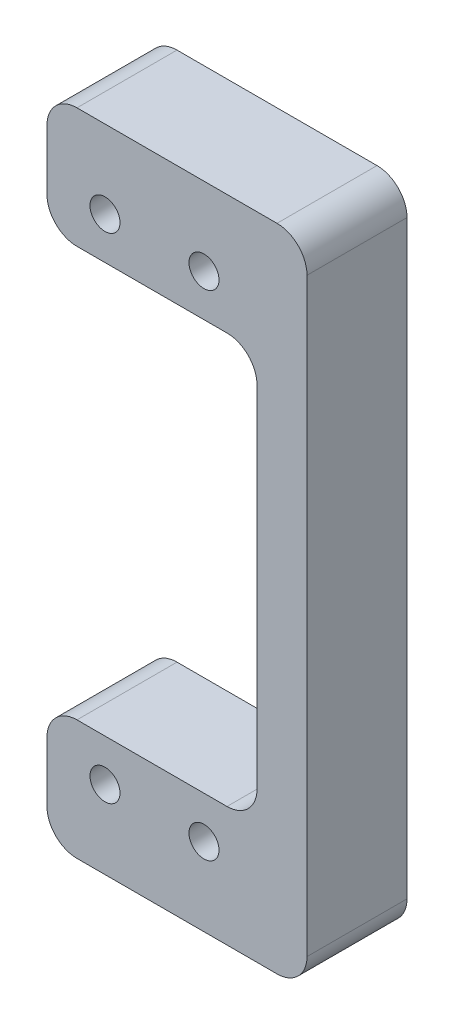
from build123d import *

# Parameters (mm, degrees)
BOSS_EXTRUDE1_DEPTH   = 10
FILLET1_R             = 3
F_3_0MM_DOWEL_HOLE1_D = 3


with BuildPart() as part:
    # Sketch1 → Boss-Extrude1 (new body)
    with BuildSketch(Plane.XY):
        Polygon((0, -20.5), (0, 20.5), (-21, 20.5), (-21, 32.5), (5, 32.5), (5, -32.5), (-21, -32.5), (-21, -20.5), align=None)
    extrude(amount=BOSS_EXTRUDE1_DEPTH)

    # Fillet1
    fillet1_edges = [part.edges().sort_by_distance(p)[0] for p in [
        (0, -20.5, 5),
        (0, 20.5, 5),
        (-21, 20.5, 5),
        (-21, 32.5, 5),
        (5, 32.5, 5),
        (5, -32.5, 5),
        (-21, -32.5, 5),
        (-21, -20.5, 5),
    ]]
    fillet(fillet1_edges, radius=FILLET1_R)

    # Ø3.0mm Dowel Hole1 (through all)
    with Locations(Plane.XY.offset(10)):
        with Locations((-5.3, 24.695), (-15.2, 24.695)):
            f_3_0mm_dowel_hole1 = Hole(F_3_0MM_DOWEL_HOLE1_D / 2)

    # Mirror1: Ø3.0mm Dowel Hole1 across plane
    add(f_3_0mm_dowel_hole1.mirror(Plane.ZX), mode=Mode.SUBTRACT)


solid = part.part
